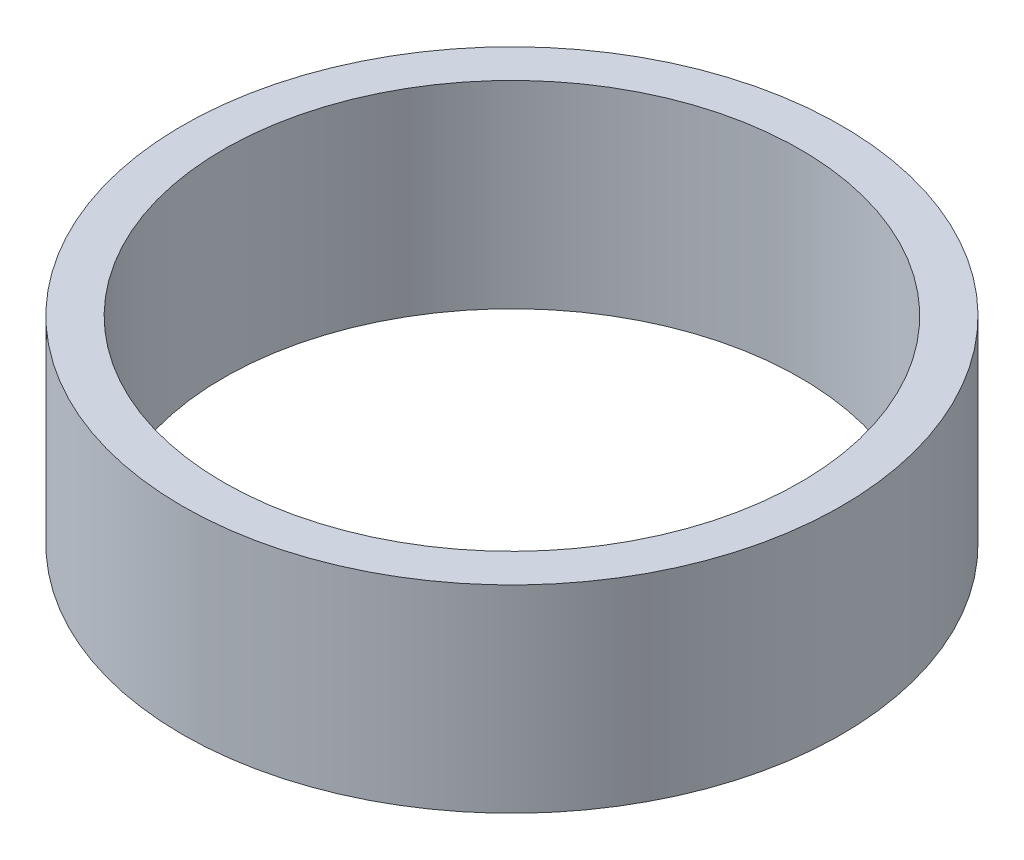
from build123d import *

# Parameters (mm, degrees)
SKETCH_1_R      = 20
SKETCH_1_R_2    = 17.5
EXTRUDE_1_DEPTH = 12


with BuildPart() as part:
    # 草图1 → 凸台-拉伸1 (new body)
    with BuildSketch(Plane(origin=(0, 0, 0), x_dir=(1, 0, 0), z_dir=(0, 1, 0))):
        with Locations(Location((0, 0, 0), (0, 0, 270))):
            Circle(SKETCH_1_R)
        with Locations(Location((0, 0, 0), (0, 0, 270))):
            Circle(SKETCH_1_R_2, mode=Mode.SUBTRACT)
    extrude(amount=EXTRUDE_1_DEPTH)


solid = part.part
